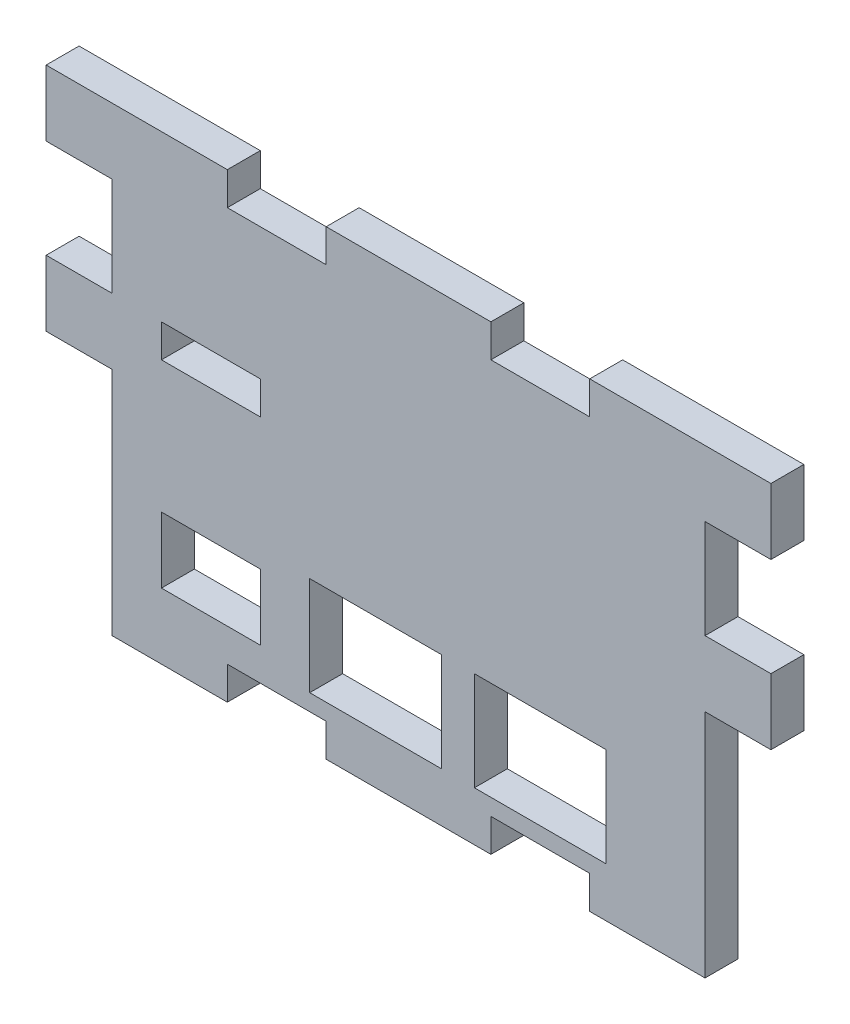
from build123d import *

# Parameters (mm, degrees)
ESQUISSE1_W             = 110
ESQUISSE1_H             = 70
BOSS_EXTRU_1_DEPTH      = 5
ESQUISSE2_W             = 20
ESQUISSE2_H             = 15
ESQUISSE2_W_2           = 15
ESQUISSE2_H_2           = 10
ESQUISSE2_H_3           = 5
ENL_V_MAT_EXTRU_1_DEPTH = 5
ESQUISSE6_W             = 10
ESQUISSE6_H             = 35
ESQUISSE6_H_2           = 15
ESQUISSE6_W_2           = 15
ESQUISSE6_H_3           = 5
ENL_V_MAT_EXTRU_2_DEPTH = 5


with BuildPart() as part:
    # Esquisse1 → Boss.-Extru.1 (new body)
    with BuildSketch(Plane.XY):
        Rectangle(ESQUISSE1_W, ESQUISSE1_H)
    extrude(amount=BOSS_EXTRU_1_DEPTH)

    # Esquisse2 → Enlèv. mat.-Extru.1 (cut)
    with BuildSketch(Plane.XY.offset(5)):
        with Locations((20, -20)):
            Rectangle(ESQUISSE2_W, ESQUISSE2_H)
        with Locations((-5, -20)):
            Rectangle(ESQUISSE2_W, ESQUISSE2_H)
        with Locations((-30, -20)):
            Rectangle(ESQUISSE2_W_2, ESQUISSE2_H_2)
        with Locations((-30, 7.5)):
            Rectangle(ESQUISSE2_W_2, ESQUISSE2_H_3)
    extrude(amount=-ENL_V_MAT_EXTRU_1_DEPTH, mode=Mode.SUBTRACT)

    # Esquisse6 → Enlèv. mat.-Extru.2 (cut)
    with BuildSketch(Plane(origin=(0, 0, 0), x_dir=(-1, 0, 0), z_dir=(0, 0, -1))):
        with Locations((-50, -17.5)):
            Rectangle(ESQUISSE6_W, ESQUISSE6_H)
        with Locations((50, -17.5)):
            Rectangle(ESQUISSE6_W, ESQUISSE6_H)
        with Locations((-50, 17.5)):
            Rectangle(ESQUISSE6_W, ESQUISSE6_H_2)
        with Locations((50, 17.5)):
            Rectangle(ESQUISSE6_W, ESQUISSE6_H_2)
        with Locations((-20, 32.5)):
            Rectangle(ESQUISSE6_W_2, ESQUISSE6_H_3)
        with Locations((20, 32.5)):
            Rectangle(ESQUISSE6_W_2, ESQUISSE6_H_3)
        with Locations((-20, -32.5)):
            Rectangle(ESQUISSE6_W_2, ESQUISSE6_H_3)
        with Locations((20, -32.5)):
            Rectangle(ESQUISSE6_W_2, ESQUISSE6_H_3)
    extrude(amount=-ENL_V_MAT_EXTRU_2_DEPTH, mode=Mode.SUBTRACT)


solid = part.part
